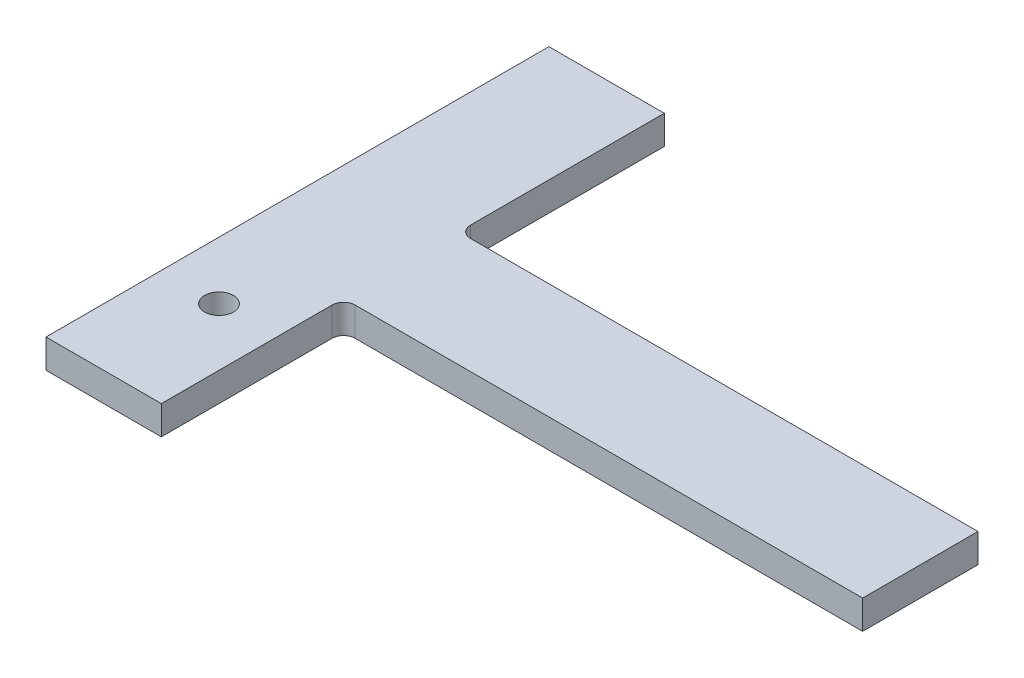
from build123d import *

# Parameters (mm, degrees)
SKETCH2_R           = 3.175
BOSS_EXTRUDE1_DEPTH = 6.35
FILLET1_R           = 2.54


with BuildPart() as part:
    # Sketch2 → Boss-Extrude1 (new body)
    with BuildSketch(Plane(origin=(0, 0, 0), x_dir=(1, 0, 0), z_dir=(0, 1, 0))):
        Polygon((-16.625454545, 1.454727273), (-16.625454545, -38.677272727), (-42.025454545, -38.677272727), (-42.025454545, 72.066727273), (-16.625454545, 72.066727273), (-16.625454545, 26.854727273), (97.674545455, 26.854727273), (97.674545455, 1.454727273), align=None)
        with Locations(Location((-29.325454545, -13.277272727, 0), (0, 0, 270))):
            Circle(SKETCH2_R, mode=Mode.SUBTRACT)
    extrude(amount=BOSS_EXTRUDE1_DEPTH)

    # Fillet1
    fillet1_edges = [part.edges().sort_by_distance(p)[0] for p in [
        (-16.625454545, 3.175, -26.854727273),
        (-16.625454545, 3.175, -1.454727273),
    ]]
    fillet(fillet1_edges, radius=FILLET1_R)


solid = part.part
